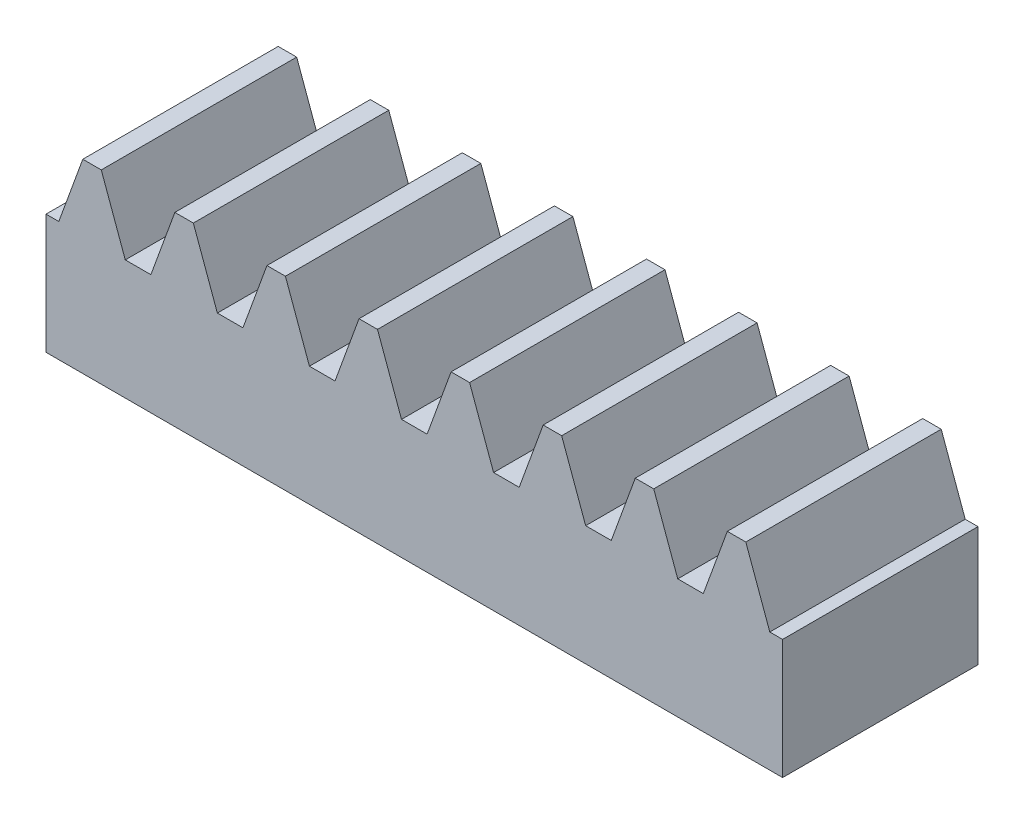
from build123d import *

# Parameters (mm, degrees)
EXTRUIR1_DEPTH = 10


with BuildPart() as part:
    # Croquis4 → Extruir1 (new body)
    with BuildSketch(Plane.XY):
        Polygon((32.33206977, 6.125), (31.10367023, 9.5), (30.157386445, 9.5), (28.928986905, 6.125), (27.619680795, 6.125), (26.391281255, 9.5), (25.44499747, 9.5), (24.21659793, 6.125), (22.90729182, 6.125), (21.67889228, 9.5), (20.732608495, 9.5), (19.504208955, 6.125), (18.194902845, 6.125), (16.966503305, 9.5), (16.02021952, 9.5), (14.79181998, 6.125), (13.48251387, 6.125), (12.25411433, 9.5), (11.307830545, 9.5), (10.079431005, 6.125), (8.770124895, 6.125), (7.541725355, 9.5), (6.59544157, 9.5), (5.36704203, 6.125), (4.05773592, 6.125), (2.82933638, 9.5), (1.883052595, 9.5), (0.654653055, 6.125), (0, 6.125), (0, 0), (37.6991118, 0), (37.6991118, 6.125), (37.044458745, 6.125), (35.816059205, 9.5), (34.86977542, 9.5), (33.64137588, 6.125), align=None)
    extrude(amount=EXTRUIR1_DEPTH)


solid = part.part
